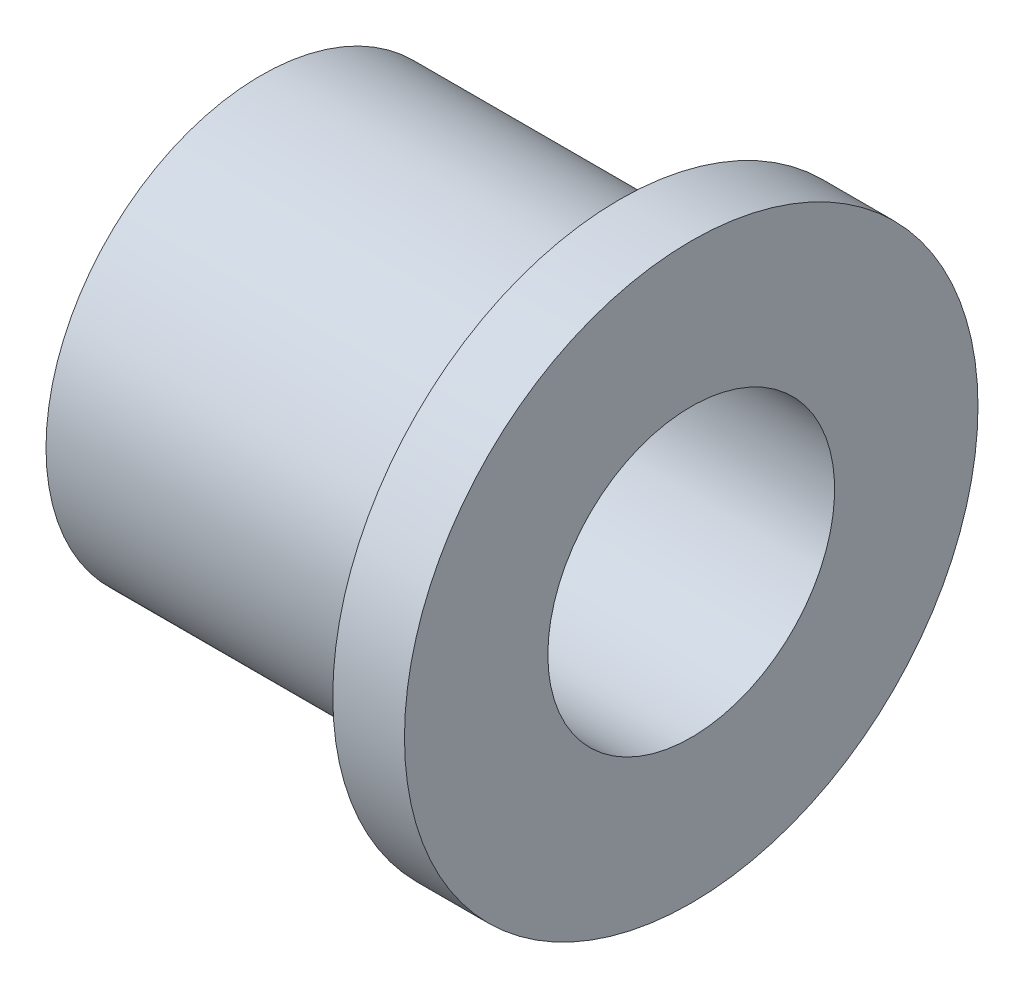
from build123d import *


with BuildPart() as part:
    # Sketch1 → Revolve1 (revolve)
    with BuildSketch(Plane(origin=(0, 0, 0), x_dir=(1, 0, 0), z_dir=(0, 1, 0)), mode=Mode.PRIVATE) as revolve1_sk:
        Polygon((0, 4), (0, 6), (10, 6), (10, 8), (12, 8), (12, 4), align=None)
    revolve(revolve1_sk.sketch.rotate(Axis((0, 0, 0), (1, 0, 0)), 180), axis=Axis((0, 0, 0), (1, 0, 0)))


solid = part.part
